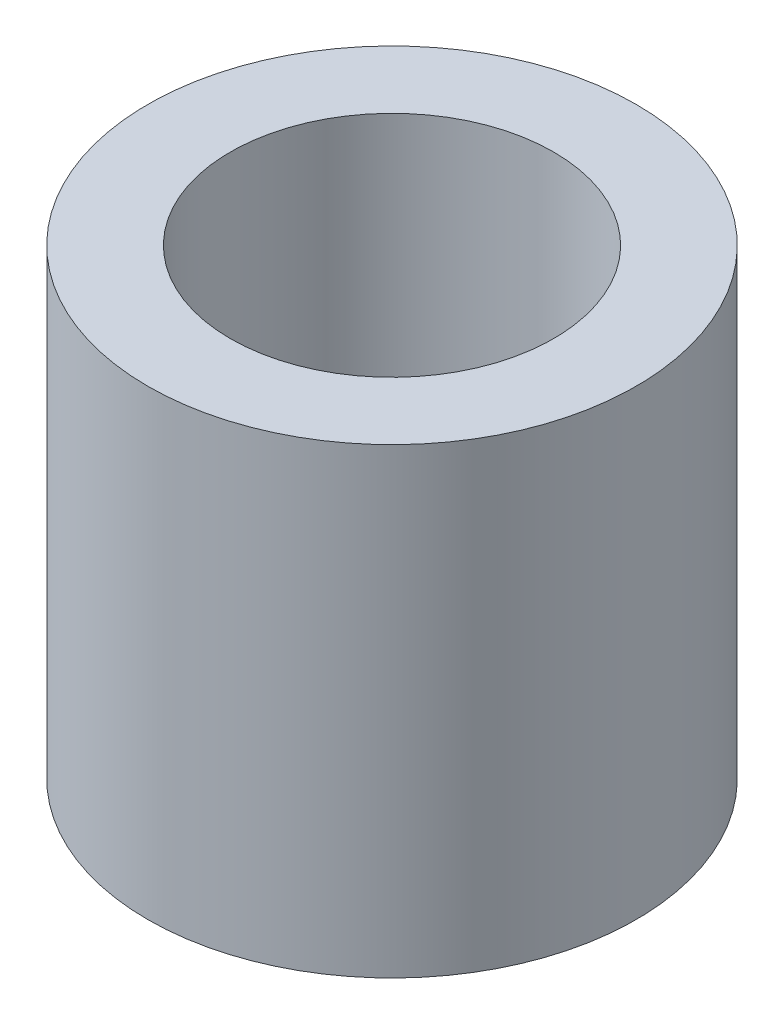
from build123d import *

# Parameters (mm, degrees)
SKETCH1_R           = 7.4
BOSS_EXTRUDE1_DEPTH = 14
SKETCH2_R           = 4.9
CUT_EXTRUDE1_DEPTH  = 18.479130413


with BuildPart() as part:
    # Sketch1 → Boss-Extrude1 (new body)
    with BuildSketch(Plane(origin=(0, 0, 0), x_dir=(1, 0, 0), z_dir=(0, 1, 0))):
        with Locations(Location((0, 0, 0), (0, 0, 270))):
            Circle(SKETCH1_R)
    extrude(amount=BOSS_EXTRUDE1_DEPTH)

    # Sketch2 → Cut-Extrude1 (cut, through all)
    with BuildSketch(Plane(origin=(0, 14, 0), x_dir=(1, 0, 0), z_dir=(0, 1, 0))):
        with Locations(Location((0, 0, 0), (0, 0, 270))):
            Circle(SKETCH2_R)
    extrude(amount=-CUT_EXTRUDE1_DEPTH, mode=Mode.SUBTRACT)


solid = part.part
